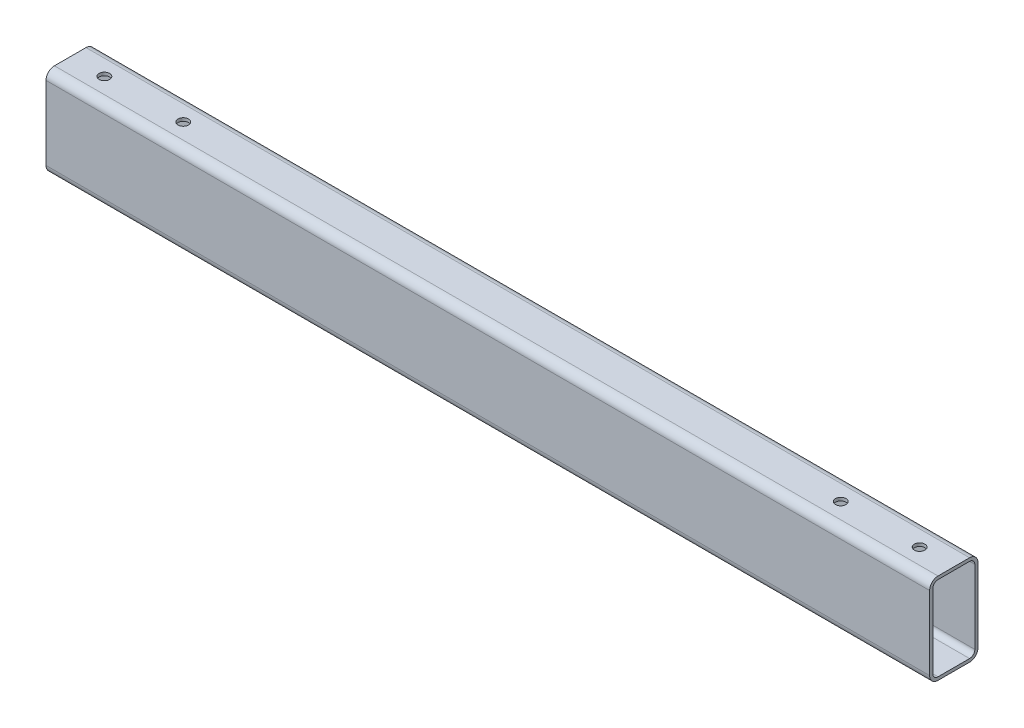
from build123d import *

# Parameters (mm, degrees)
EXTRUDE_THIN1_DEPTH      = 420
EXTRUDE_THIN1_DEPTH_BACK = 420
CUT_EXTRUDE1_DEPTH       = 423.82147533
CUT_EXTRUDE1_DEPTH_BACK  = 423.82147533
SKETCH3_R                = 5


with BuildPart() as part:
    # Sketch1 → Extrude-Thin1 (new, two sides: drawn at the far end of the back side and taken through both)
    with BuildSketch(Plane(origin=(0, 0, 0), x_dir=(0, 0, -1), z_dir=(1, 0, 0)).offset(-EXTRUDE_THIN1_DEPTH_BACK)):
        with BuildLine():
            Line((-23, 35), (-23, -35))
            ThreePointArc((-23, -35), (-20.656854249, -40.656854249), (-15, -43))
            Line((-15, -43), (15, -43))
            ThreePointArc((15, -43), (20.656854249, -40.656854249), (23, -35))
            Line((23, -35), (23, 35))
            ThreePointArc((23, 35), (20.656854249, 40.656854249), (15, 43))
            Line((15, 43), (-15, 43))
            ThreePointArc((-15, 43), (-20.656854249, 40.656854249), (-23, 35))
        make_face()
        with BuildLine():
            Line((-20, 35), (-20, -35))
            ThreePointArc((-20, -35), (-18.535533906, -38.535533906), (-15, -40))
            Line((-15, -40), (15, -40))
            ThreePointArc((15, -40), (18.535533906, -38.535533906), (20, -35))
            Line((20, -35), (20, 35))
            ThreePointArc((20, 35), (18.535533906, 38.535533906), (15, 40))
            Line((15, 40), (-15, 40))
            ThreePointArc((-15, 40), (-18.535533906, 38.535533906), (-20, 35))
        make_face(mode=Mode.SUBTRACT)
    extrude(amount=EXTRUDE_THIN1_DEPTH + EXTRUDE_THIN1_DEPTH_BACK)

    # Sketch3 → Cut-Extrude1 (cut, two sides: drawn at the far end of the back side and taken through both)
    with BuildSketch(Plane(origin=(0, 0, 0), x_dir=(1, 0, 0), z_dir=(0, 1, 0)).offset(-CUT_EXTRUDE1_DEPTH_BACK)):
        with Locations(Location((-387.5, 0, 0), (0, 0, 270))):
            Circle(SKETCH3_R)
        with Locations(Location((-312.5, 0, 0), (0, 0, 270))):
            Circle(SKETCH3_R)
        with Locations(Location((387.5, 0, 0), (0, 0, 90))):
            Circle(SKETCH3_R)
        with Locations(Location((312.5, 0, 0), (0, 0, 90))):
            Circle(SKETCH3_R)
    extrude(amount=CUT_EXTRUDE1_DEPTH + CUT_EXTRUDE1_DEPTH_BACK, mode=Mode.SUBTRACT)


solid = part.part
